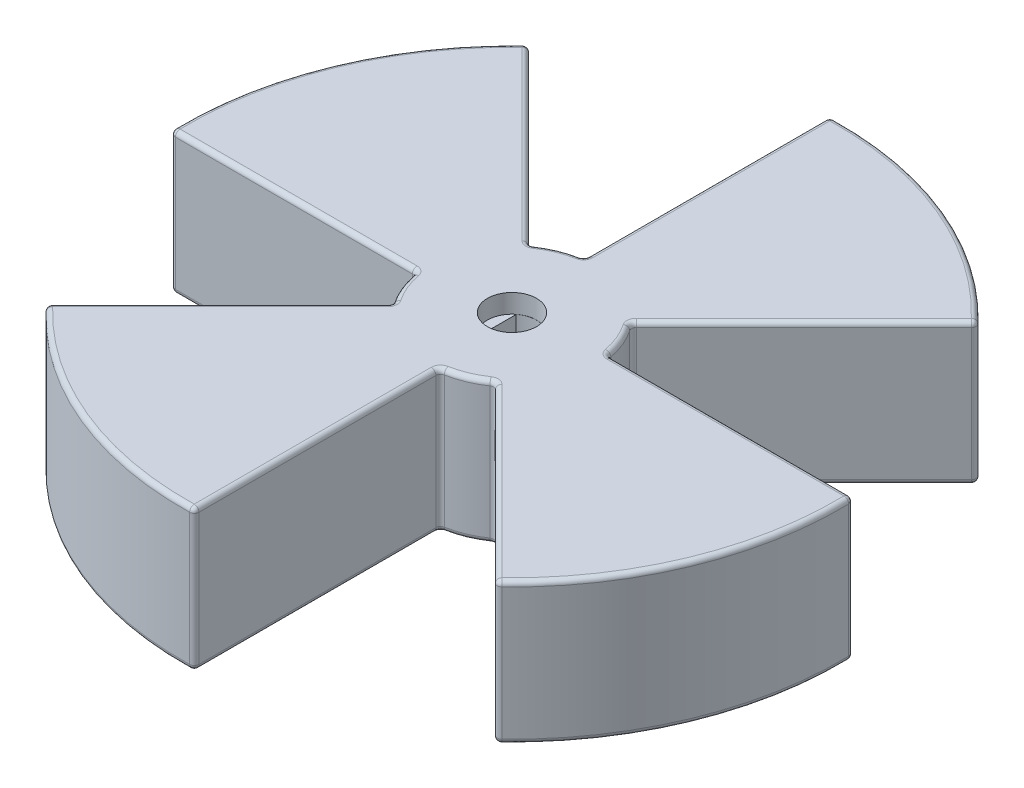
from build123d import *

# Parameters (mm, degrees)
SKETCH1_R           = 9
BOSS_EXTRUDE1_DEPTH = 15
SKETCH4_W           = 27
SKETCH4_H           = 2.5
BOSS_EXTRUDE2_DEPTH = 15
CIRPATTERN1_COUNT   = 8
SKETCH6_R           = 2.61
CUT_EXTRUDE2_DEPTH  = 2
BOSS_EXTRUDE3_DEPTH = 15
CIRPATTERN2_COUNT   = 4
FILLET1_R           = 0.5
CUT_EXTRUDE3_DEPTH  = 13
CIRPATTERN3_COUNT   = 4
SKETCH9_R           = 2.602415143
CUT_EXTRUDE4_DEPTH  = 3


with BuildPart() as part:
    # Sketch1 → Boss-Extrude1 (new body)
    with BuildSketch(Plane(origin=(0, 0, 0), x_dir=(1, 0, 0), z_dir=(0, 1, 0))):
        with Locations(Location((0, 0, 0), (0, 0, 270))):
            Circle(SKETCH1_R)
        with BuildLine():
            Line((1.6, -2.049390153), (1.6, 2.049390153))
            ThreePointArc((1.6, 2.049390153), (0, 2.6), (-1.6, 2.049390153))
            Line((-1.6, 2.049390153), (-1.6, -2.049390153))
            ThreePointArc((-1.6, -2.049390153), (0, -2.6), (1.6, -2.049390153))
        make_face(mode=Mode.SUBTRACT)
    extrude(amount=BOSS_EXTRUDE1_DEPTH)

    # Sketch4 → Boss-Extrude2 (add)
    with BuildSketch(Plane(origin=(0, 0, 0), x_dir=(1, 0, 0), z_dir=(0, 1, 0))):
        with Locations((21.5, 0)):
            Rectangle(SKETCH4_W, SKETCH4_H)
    boss_extrude2 = extrude(amount=BOSS_EXTRUDE2_DEPTH)

    # CirPattern1: Boss-Extrude2 ×8 about axis
    cirpattern1_axis = Axis((0, 0, 0), (0, 1, 0))
    for i in range(1, CIRPATTERN1_COUNT):
        add(boss_extrude2.rotate(cirpattern1_axis, i * 360 / CIRPATTERN1_COUNT))

    # Sketch6 → Cut-Extrude2 (cut)
    with BuildSketch(Plane(origin=(0, 15, 0), x_dir=(1, 0, 0), z_dir=(0, 1, 0))):
        with Locations(Location((0, 0, 0), (0, 0, 270))):
            Circle(SKETCH6_R)
    extrude(amount=-CUT_EXTRUDE2_DEPTH, mode=Mode.SUBTRACT)

    # Sketch7 → Boss-Extrude3 (add)
    with BuildSketch(Plane(origin=(0, 0, 0), x_dir=(1, 0, 0), z_dir=(0, 1, 0))):
        with BuildLine():
            Line((-1.25, 35), (-0.249840714, 6.99553998))
            ThreePointArc((-0.249840714, 6.99553998), (2.678784027, 6.467156728), (5.123257821, 4.769929695))
            Line((5.123257821, 4.769929695), (25.632620818, 23.864853865))
            ThreePointArc((25.632620818, 23.864853865), (13.402459452, 32.356399377), (-1.25, 35))
        make_face()
    boss_extrude3 = extrude(amount=BOSS_EXTRUDE3_DEPTH)

    # CirPattern2: Boss-Extrude3 ×4 about axis
    cirpattern2_axis = Axis((0, 15, 0), (0, 1, 0))
    for i in range(1, CIRPATTERN2_COUNT):
        add(boss_extrude3.rotate(cirpattern2_axis, i * 360 / CIRPATTERN2_COUNT))

    # Fillet1
    fillet1_edges = [part.edges().sort_by_distance(p)[0] for p in [
        (-21.956385867, 15, 1.25),
        (-7.186164809, 7.5, 5.418397856),
        (-16.409392814, 0, 14.641625861),
        (-25.632620818, 7.5, 23.864853865),
        (-16.409392814, 15, 14.641625861),
        (3.444150891, 0, 8.314915793),
        (3.444150891, 15, 8.314915793),
        (1.25, 0, 21.956385867),
        (1.25, 7.5, 8.912771735),
        (1.25, 7.5, 35),
        (1.25, 15, 21.956385867),
        (5.418397856, 7.5, 7.186164809),
        (14.641625861, 0, 16.409392814),
        (23.864853865, 7.5, 25.632620818),
        (14.641625861, 15, 16.409392814),
        (13.402459452, 0, -32.356399377),
        (13.402459452, 15, -32.356399377),
        (8.314915793, 15, -3.444150891),
        (8.314915793, 0, -3.444150891),
        (8.912771735, 7.5, -1.25),
        (-32.356399377, 0, -13.402459452),
        (-32.356399377, 15, -13.402459452),
        (-13.402459452, 0, 32.356399377),
        (-13.402459452, 15, 32.356399377),
        (21.956385867, 0, -1.25),
        (35, 7.5, -1.25),
        (32.356399377, 0, 13.402459452),
        (32.356399377, 15, 13.402459452),
        (21.956385867, 15, -1.25),
        (7.186164809, 7.5, -5.418397856),
        (16.409392814, 0, -14.641625861),
        (25.632620818, 7.5, -23.864853865),
        (16.409392814, 15, -14.641625861),
        (-3.444150891, 0, -8.314915793),
        (-3.444150891, 15, -8.314915793),
        (-1.25, 0, -21.956385867),
        (-1.25, 7.5, -8.912771735),
        (-1.25, 7.5, -35),
        (-1.25, 15, -21.956385867),
        (-5.418397856, 7.5, -7.186164809),
        (-14.641625861, 0, -16.409392814),
        (-23.864853865, 7.5, -25.632620818),
        (-14.641625861, 15, -16.409392814),
        (-8.314915793, 0, 3.444150891),
        (-8.314915793, 15, 3.444150891),
        (-21.956385867, 0, 1.25),
        (-8.912771735, 7.5, 1.25),
        (-35, 7.5, 1.25),
    ]]
    fillet(fillet1_edges, radius=FILLET1_R)

    # Sketch8 → Cut-Extrude3 (cut)
    with BuildSketch(Plane(origin=(0, 0, 0), x_dir=(1, 0, 0), z_dir=(0, 1, 0))):
        with BuildLine():
            Line((23.863640094, -22.095873141), (7.55891044, -5.791143487))
            ThreePointArc((7.55891044, -5.791143487), (8.797471298, -3.644031926), (9.439913661, -1.25))
            Line((9.439913661, -1.25), (32.498283469, -1.25))
            ThreePointArc((32.498283469, -1.25), (30.046700546, -12.445750871), (23.863640094, -22.095873141))
        make_face()
    cut_extrude3 = extrude(amount=CUT_EXTRUDE3_DEPTH, mode=Mode.SUBTRACT)

    # CirPattern3: Cut-Extrude3 ×4 about axis
    cirpattern3_axis = Axis((0, 0, 0), (0, 1, 0))
    for i in range(1, CIRPATTERN3_COUNT):
        add(cut_extrude3.rotate(cirpattern3_axis, i * 360 / CIRPATTERN3_COUNT), mode=Mode.SUBTRACT)

    # Sketch9 → Cut-Extrude4 (cut)
    with BuildSketch(Plane(origin=(0, 0, 0), x_dir=(1, 0, 0), z_dir=(0, 1, 0))):
        with Locations(Location((0, 0, 0), (0, 0, 270))):
            Circle(SKETCH9_R)
    extrude(amount=CUT_EXTRUDE4_DEPTH, mode=Mode.SUBTRACT)


solid = part.part
